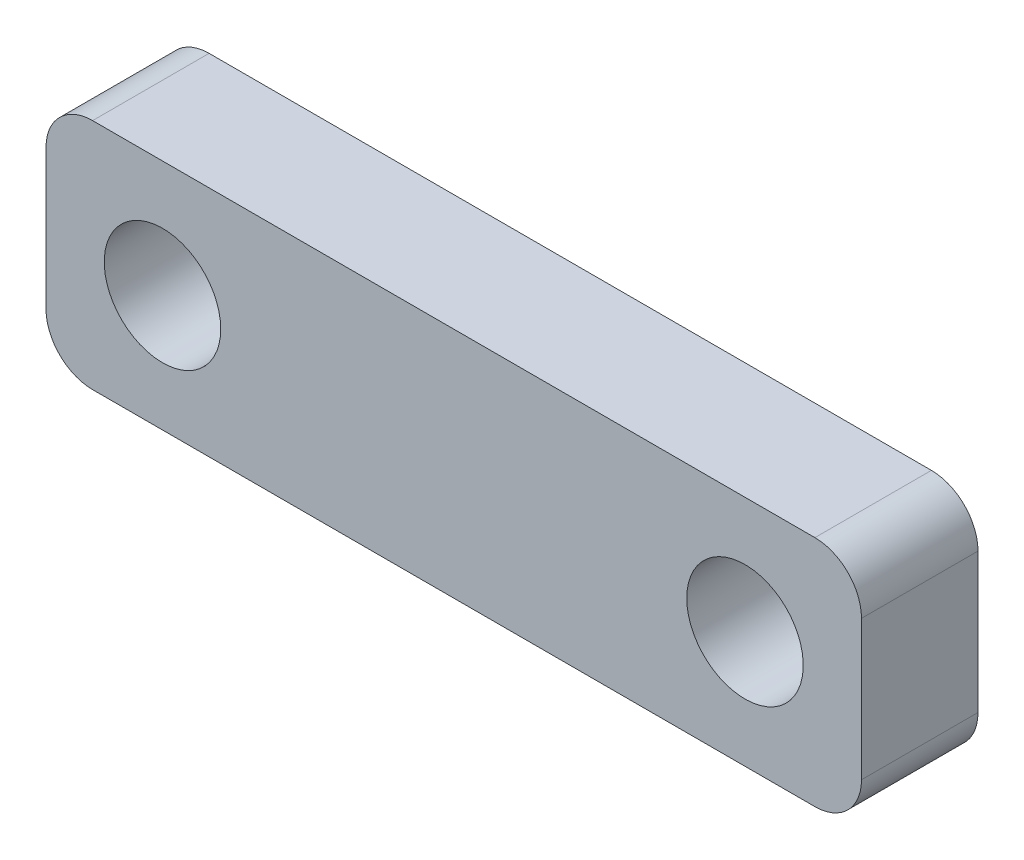
from build123d import *

# Parameters (mm, degrees)
ESQUISSE1_W        = 35
ESQUISSE1_H        = 10
ESQUISSE1_R        = 2.5
BOSS_EXTRU_1_DEPTH = 5
CONG_1_R           = 2
CONG_2_R           = 2
CONG_3_R           = 2
CONG_4_R           = 2


with BuildPart() as part:
    # Esquisse1 → Boss.-Extru.1 (new body)
    with BuildSketch(Plane.XY):
        with Locations((1.158413849, 3.369565217)):
            Rectangle(ESQUISSE1_W, ESQUISSE1_H)
        with Locations((-11.341586151, 3.369565217)):
            Circle(ESQUISSE1_R, mode=Mode.SUBTRACT)
        with Locations(Location((13.658413849, 3.369565217, 0), (0, 0, 180))):
            Circle(ESQUISSE1_R, mode=Mode.SUBTRACT)
    extrude(amount=BOSS_EXTRU_1_DEPTH)

    # Congé1
    cong_1_edges = [part.edges().sort_by_distance(p)[0] for p in [
        (-16.341586151, 8.369565217, 2.5),
    ]]
    fillet(cong_1_edges, radius=CONG_1_R)

    # Congé2
    cong_2_edges = [part.edges().sort_by_distance(p)[0] for p in [
        (-16.341586151, -1.630434783, 2.5),
    ]]
    fillet(cong_2_edges, radius=CONG_2_R)

    # Congé3
    cong_3_edges = [part.edges().sort_by_distance(p)[0] for p in [
        (18.658413849, 8.369565217, 2.5),
    ]]
    fillet(cong_3_edges, radius=CONG_3_R)

    # Congé4
    cong_4_edges = [part.edges().sort_by_distance(p)[0] for p in [
        (18.658413849, -1.630434783, 2.5),
    ]]
    fillet(cong_4_edges, radius=CONG_4_R)


solid = part.part
